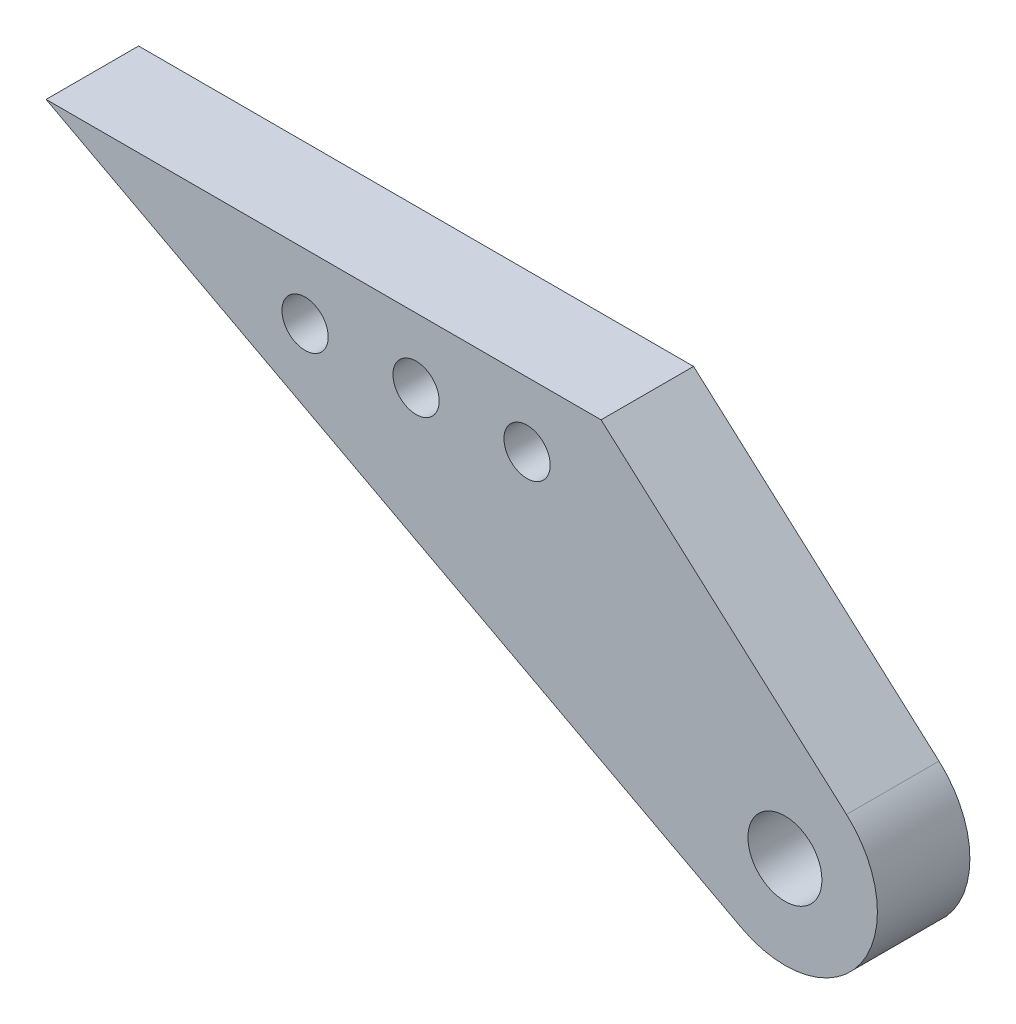
from build123d import *

# Parameters (mm, degrees)
SKETCH_2_R      = 1.25
SKETCH_2_R_2    = 2
EXTRUDE_1_DEPTH = 5


with BuildPart() as part:
    # 草图2 → 凸台-拉伸1 (new body)
    with BuildSketch(Plane.XY):
        with BuildLine():
            Line((-30, 0), (0, 0))
            Line((0, 0), (13.267587729, -11.842405135))
            ThreePointArc((13.267587729, -11.842405135), (14.040050176, -18.431598005), (7.590722945, -19.987341933))
            Line((7.590722945, -19.987341933), (-30, 0))
        make_face()
        with Locations((-4, -3.5)):
            Circle(SKETCH_2_R, mode=Mode.SUBTRACT)
        with Locations((9.938080759, -15.572603969)):
            Circle(SKETCH_2_R_2, mode=Mode.SUBTRACT)
        with Locations((-10, -3.5)):
            Circle(SKETCH_2_R, mode=Mode.SUBTRACT)
        with Locations((-16, -3.5)):
            Circle(SKETCH_2_R, mode=Mode.SUBTRACT)
    extrude(amount=EXTRUDE_1_DEPTH)


solid = part.part
